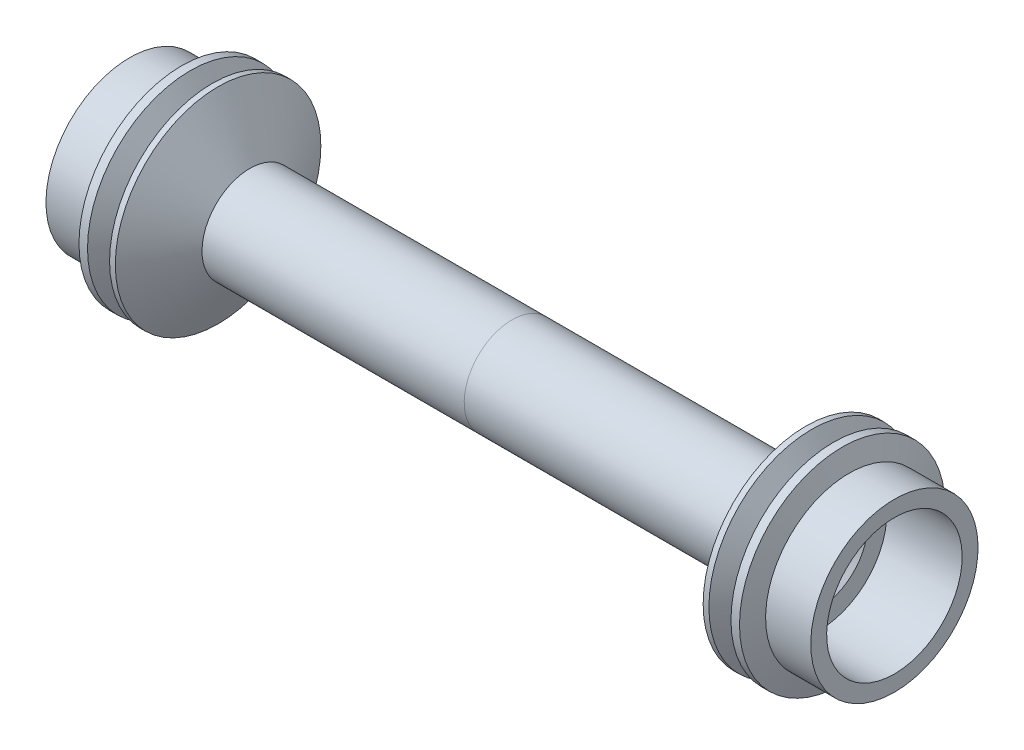
from build123d import *

# Parameters (mm, degrees)
CHAMFER1_SIZE = 0.508


with BuildPart() as part:
    # Sketch2 → Revolve1 (revolve)
    with BuildSketch(Plane.XY, mode=Mode.PRIVATE) as revolve1_sk:
        Polygon((-22.4, 5.55625), (-25.4, 5.55625), (-25.4, 4.5), (-20.4, 4.5), (-20.4, 3.23), (-19.892, 2.722), (-19.892, 1.7145), (-15.575, 1.7145), (-15.575, 0), (-14.1, 0), (-12.5, 1.6), (0, 1.6), (0, 3.175), (-17.415214988, 3.175), (-19.523265158, 6.82625), (-19.904265158, 6.82625), (-20.6375, 5.55625), (-21.370734842, 6.82625), (-21.937757802, 6.82625), align=None)
    revolve(revolve1_sk.sketch.rotate(Axis((-25.4, 0, 0), (1, 0, 0)), 180), axis=Axis((-25.4, 0, 0), (1, 0, 0)))


with BuildPart() as body_2:
    # Mirror1: mirrored copy
    add(part.part.mirror(Plane(origin=(0, 0, 0), x_dir=(0, 0, 1), z_dir=(1, 0, 0))))


with BuildPart() as part_1:
    add(part.part)

    # Chamfer1
    chamfer1_edges = [part_1.edges().sort_by_distance(p)[0] for p in [
        (-25.4, 4.5, 0),
    ]]
    chamfer(chamfer1_edges, length=CHAMFER1_SIZE)


solid = Compound([body_2.part, part_1.part])
